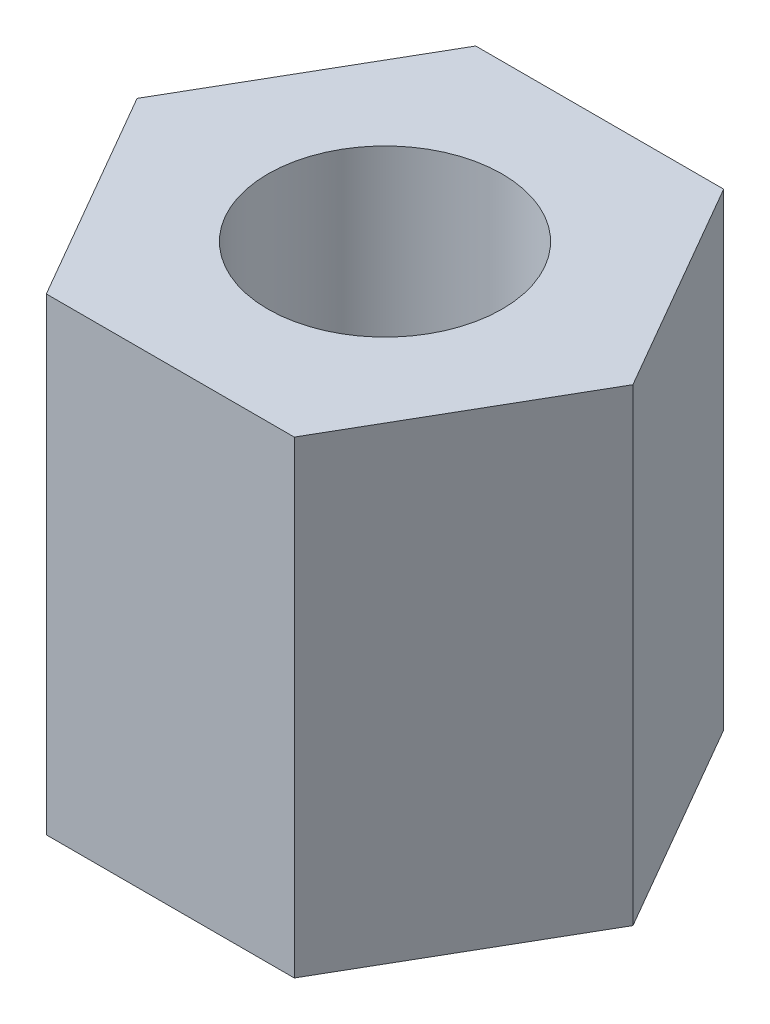
from build123d import *

# Parameters (mm, degrees)
SKETCH_1_R      = 1.5
EXTRUDE_1_DEPTH = 6


with BuildPart() as part:
    # Эскиз1 → Бобышка-Вытянуть1 (new body)
    with BuildSketch(Plane(origin=(0, 0, 0), x_dir=(1, 0, 0), z_dir=(0, 1, 0))):
        Polygon((3.175426481, 0), (1.58771324, 2.75), (-1.58771324, 2.75), (-3.175426481, 0), (-1.58771324, -2.75), (1.58771324, -2.75), align=None)
        with Locations(Location((0, 0, 0), (0, 0, 270))):
            Circle(SKETCH_1_R, mode=Mode.SUBTRACT)
    extrude(amount=EXTRUDE_1_DEPTH)


solid = part.part
